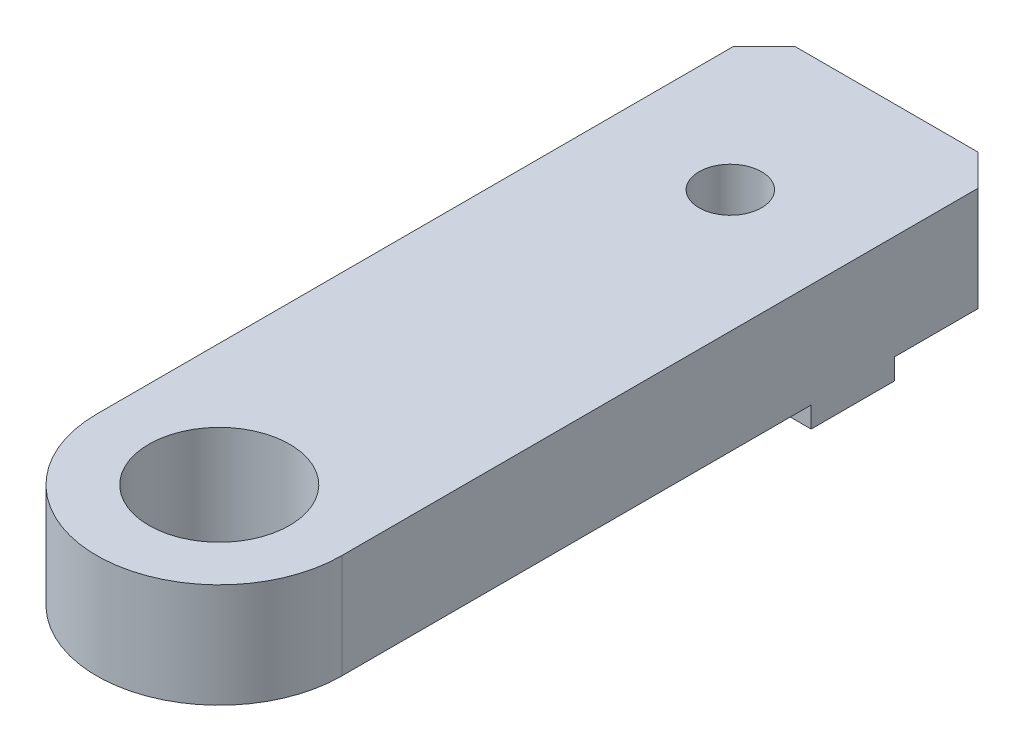
from build123d import *
from build123d.topology import SkipClean

# Parameters (mm, degrees)
SKETCH1_R           = 3
SKETCH1_R_2         = 6.75
BOSS_EXTRUDE1_DEPTH = 10
BOSS_EXTRUDE2_START = 2
SKETCH2_W           = 23.5
SKETCH2_H           = 8
SKETCH2_R           = 3
BOSS_EXTRUDE2_DEPTH = 2
CHAMFER1_SIZE       = 3
SKETCH3_R           = 6
CUT_EXTRUDE1_DEPTH  = 2
FILLET1_R           = 1


with BuildPart() as part:
    # Sketch1 → Boss-Extrude1 (new body)
    with BuildSketch(Plane(origin=(0, 0, 0), x_dir=(1, 0, 0), z_dir=(0, 1, 0))):
        with BuildLine():
            Line((-11.75, 64), (-11.75, 0))
            ThreePointArc((-11.75, 0), (0, -11.75), (11.75, 0))
            Line((11.75, 0), (11.75, 64))
            Line((11.75, 64), (-11.75, 64))
        make_face()
        with Locations(Location((0, 49, 0), (0, 0, 270))):
            Circle(SKETCH1_R, mode=Mode.SUBTRACT)
        with Locations(Location((0, 0, 0), (0, 0, 270))):
            Circle(SKETCH1_R_2, mode=Mode.SUBTRACT)
    extrude(amount=BOSS_EXTRUDE1_DEPTH)

    # Sketch2 → Boss-Extrude2 (add)
    with SkipClean():  # the faces are left unmerged after this step: merging them gives an invalid solid
        with BuildSketch(Plane.XZ.offset(BOSS_EXTRUDE2_START)):
            with Locations((0, -49)):
                Rectangle(SKETCH2_W, SKETCH2_H)
            with Locations(Location((0, -49, 0), (0, 0, 270))):
                Circle(SKETCH2_R, mode=Mode.SUBTRACT)
        extrude(amount=-BOSS_EXTRUDE2_DEPTH)

    # Chamfer1
    chamfer1_edges = [part.edges().sort_by_distance(p)[0] for p in [
        (-11.75, 5, -64),
        (11.75, 5, -64),
    ]]
    chamfer(chamfer1_edges, length=CHAMFER1_SIZE)

    # Sketch3 → Cut-Extrude1 (cut)
    with BuildSketch(Plane.XZ.offset(2)):
        with Locations((0, -49)):
            Circle(SKETCH3_R)
    extrude(amount=-CUT_EXTRUDE1_DEPTH, mode=Mode.SUBTRACT)

    # Fillet1
    fillet1_edges = [part.edges().sort_by_distance(p)[0] for p in [
        (4.472135955, -1, -53),
        (-4.472135955, -1, -53),
        (4.472135955, -1, -45),
        (-4.472135955, -1, -45),
    ]]
    fillet(fillet1_edges, radius=FILLET1_R)


solid = part.part
